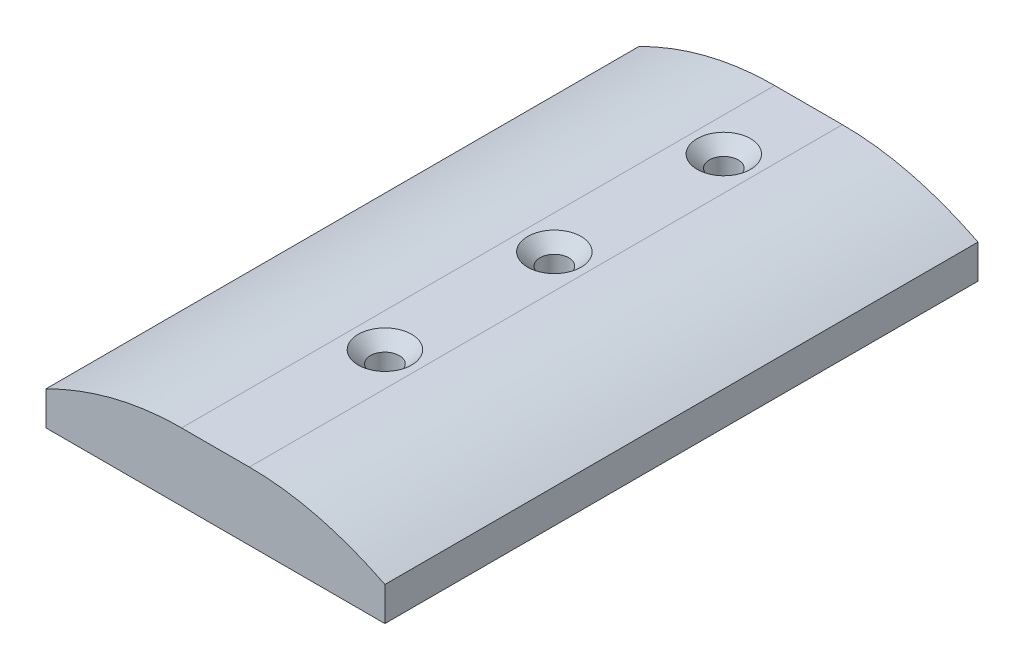
from build123d import *

# Parameters (mm, degrees)
SKETCH1_R                                       = 1.25
BOSS_EXTRUDE1_DEPTH                             = 4
BOSS_EXTRUDE2_DEPTH                             = 70
SKETCH3_R                                       = 1.6
SKETCH3_R_2                                     = 1.625
CUT_EXTRUDE1_DEPTH                              = 70
CSK_FOR_M3_FLAT_HEAD_MACHINE_SCREW1_D           = 3.4
CSK_FOR_M3_FLAT_HEAD_MACHINE_SCREW1_CSINK_D     = 6.3
CSK_FOR_M3_FLAT_HEAD_MACHINE_SCREW1_CSINK_ANGLE = 90


with BuildPart() as part:
    # Sketch1 → Boss-Extrude1 (new body)
    with BuildSketch(Plane(origin=(0, 0, 0), x_dir=(1, 0, 0), z_dir=(0, 1, 0))):
        Polygon((0, 35), (20, 35), (20, -35), (0, -35), (-20, -35), (-20, 35), align=None)
        with Locations(Location((0, 25, 0), (0, 0, 270))):
            Circle(SKETCH1_R, mode=Mode.SUBTRACT)
        with Locations(Location((0, 5, 0), (0, 0, 270))):
            Circle(SKETCH1_R, mode=Mode.SUBTRACT)
        with Locations(Location((0, -15, 0), (0, 0, 270))):
            Circle(SKETCH1_R, mode=Mode.SUBTRACT)
    extrude(amount=BOSS_EXTRUDE1_DEPTH)

    # Sketch2 → Boss-Extrude2 (add)
    with BuildSketch(Plane(origin=(0, 0, -35), x_dir=(-1, 0, 0), z_dir=(0, 0, -1))):
        with BuildLine():
            Line((0, 8), (-4, 8))
            add(Edge.make_bspline(
                [(-4, 8), (-9.652249971, 8), (-14.984519901, 6.51388548), (-20, 4)],
                knots=[0, 0, 0, 0, 1, 1, 1, 1], degree=3))
            Line((-20, 4), (20, 4))
            add(Edge.make_bspline(
                [(4, 8), (9.652249971, 8), (14.984519901, 6.51388548), (20, 4)],
                knots=[0, 0, 0, 0, 1, 1, 1, 1], degree=3))
            Line((4, 8), (0, 8))
        make_face()
    extrude(amount=-BOSS_EXTRUDE2_DEPTH)

    # Sketch3 → Cut-Extrude1 (cut)
    with BuildSketch(Plane(origin=(0, 8, 0), x_dir=(1, 0, 0), z_dir=(0, 1, 0))):
        with Locations(Location((0, 25, 0), (0, 0, 270))):
            Circle(SKETCH3_R)
        with Locations(Location((0, 5, 0), (0, 0, 270))):
            Circle(SKETCH3_R)
        with Locations(Location((0, -15, 0), (0, 0, 270))):
            Circle(SKETCH3_R_2)
    extrude(amount=-CUT_EXTRUDE1_DEPTH, mode=Mode.SUBTRACT)

    # CSK for M3 Flat Head Machine Screw1 (through all)
    with Locations(Plane(origin=(0, 8, 0), x_dir=(1, 0, 0), z_dir=(0, 1, 0))):
        with Locations((0, 25), (0, 5), (0, -15)):
            CounterSinkHole(CSK_FOR_M3_FLAT_HEAD_MACHINE_SCREW1_D / 2, CSK_FOR_M3_FLAT_HEAD_MACHINE_SCREW1_CSINK_D / 2, counter_sink_angle=CSK_FOR_M3_FLAT_HEAD_MACHINE_SCREW1_CSINK_ANGLE)


solid = part.part
